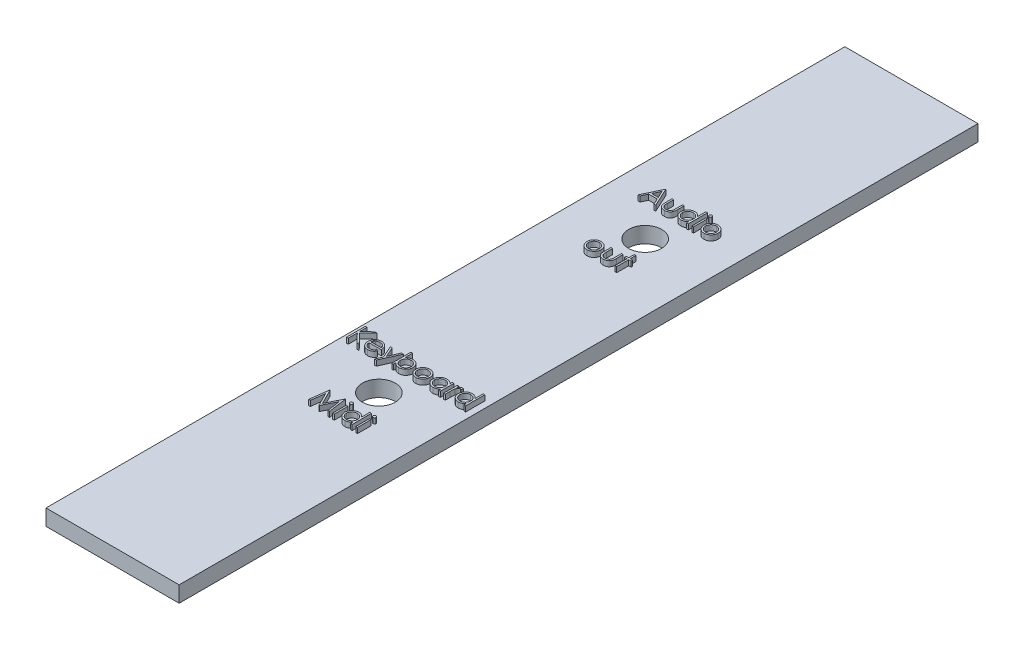
from build123d import *

# Parameters (mm, degrees)
SKETCH1_W           = 25
SKETCH1_H           = 150
SKETCH1_R           = 3.1
BOSS_EXTRUDE1_DEPTH = 3
SKETCH2_W           = 0.314102564
SKETCH2_H           = 2.557692308
BOSS_EXTRUDE2_DEPTH = 1


with BuildPart() as part:
    # Sketch1 → Boss-Extrude1 (new body)
    with BuildSketch(Plane(origin=(0, 0, 0), x_dir=(1, 0, 0), z_dir=(0, 1, 0))):
        with Locations((12.5, -75)):
            Rectangle(SKETCH1_W, SKETCH1_H)
        with Locations(Location((12.5, -50, 0), (0, 0, 270))):
            Circle(SKETCH1_R, mode=Mode.SUBTRACT)
        with Locations(Location((12.5, -100, 0), (0, 0, 270))):
            Circle(SKETCH1_R, mode=Mode.SUBTRACT)
    extrude(amount=BOSS_EXTRUDE1_DEPTH)

    # Sketch2 → Boss-Extrude2 (add)
    # profile 1 of 23: a face of its own
    with BuildSketch(Plane(origin=(0, 3, 0), x_dir=(1, 0, 0), z_dir=(0, 1, 0))):
        Polygon((7.384615385, -41), (9, -44.5), (8.658553686, -44.5), (8.141125801, -43.378205128), (6.554487179, -43.378205128), (6.022335737, -44.5), (5.679487179, -44.5), (7.33974359, -41), align=None)
        Polygon((7.358673878, -41.682191506), (6.724859776, -43.019230769), (7.975661058, -43.019230769), align=None, mode=Mode.SUBTRACT)
    # profile 2 of 23: a face of its own
    with BuildSketch(Plane(origin=(0, 3, 0), x_dir=(1, 0, 0), z_dir=(0, 1, 0))):
        with BuildLine():
            Line((9.493589744, -41.942307692), (9.807692308, -41.942307692))
            Line((9.807692308, -41.942307692), (9.807692308, -43.128605769))
            add(Edge.make_bspline(
                [(9.807692308, -43.128605769), (9.807834213, -43.163428518), (9.80810567, -43.230042806), (9.809946611, -43.325897993), (9.814276705, -43.413314706), (9.819690529, -43.492343443), (9.826652665, -43.562970834), (9.834936026, -43.624950191), (9.844194447, -43.678984375), (9.853257161, -43.711527731), (9.857471955, -43.72666266)],
                knots=[0, 0, 0, 0, 1.388932606, 2.656963016, 3.823490214, 4.879454478, 5.816252168, 6.653371382, 7.373723809, 8, 8, 8, 8], degree=3))
            add(Edge.make_bspline(
                [(9.857471955, -43.72666266), (9.86423341, -43.745685531), (9.877615751, -43.783335792), (9.901889235, -43.837724798), (9.931917571, -43.88810008), (9.964777399, -43.936404153), (10.002676807, -43.98120614), (10.045136278, -44.022430383), (10.090734515, -44.061634474), (10.158489538, -44.108019266), (10.251148804, -44.157734597), (10.37280156, -44.200630415), (10.504705786, -44.226266235), (10.595870505, -44.22924049), (10.642728365, -44.230769231)],
                knots=[0, 0, 0, 0, 0.725840625, 1.436591201, 2.137033971, 2.831655856, 3.53531722, 4.242432219, 4.957935707, 5.694543706, 7.190802206, 8.724350549, 10.316345118, 12, 12, 12, 12], degree=3))
            add(Edge.make_bspline(
                [(10.642728365, -44.230769231), (10.689581873, -44.229207982), (10.780234741, -44.226187255), (10.910689711, -44.201403716), (11.029941125, -44.159998027), (11.136792076, -44.102190616), (11.230757917, -44.031448553), (11.309062335, -43.948439744), (11.37366959, -43.855790357), (11.401879011, -43.786666078), (11.416065705, -43.751903045)],
                knots=[0, 0, 0, 0, 1.157059328, 2.238695713, 3.266970494, 4.264342957, 5.228770407, 6.160125903, 7.074715775, 8, 8, 8, 8], degree=3))
            add(Edge.make_bspline(
                [(11.416065705, -43.751903045), (11.420259935, -43.737936746), (11.429532354, -43.707060671), (11.439494705, -43.654680922), (11.448469167, -43.592216318), (11.456132343, -43.519258109), (11.461597505, -43.435996957), (11.464543532, -43.342458881), (11.467871807, -43.23893752), (11.467922323, -43.166469761), (11.467948718, -43.128605769)],
                knots=[0, 0, 0, 0, 0.557542046, 1.232589297, 2.036731608, 2.971723315, 4.038036528, 5.22795436, 6.551621927, 8, 8, 8, 8], degree=3))
            Line((11.467948718, -43.128605769), (11.467948718, -41.942307692))
            Line((11.467948718, -41.942307692), (11.782051282, -41.942307692))
            Line((11.782051282, -41.942307692), (11.782051282, -43.1875))
            add(Edge.make_bspline(
                [(11.782051282, -43.1875), (11.781609587, -43.229807171), (11.780752639, -43.311888871), (11.775245295, -43.431172983), (11.765795683, -43.542335228), (11.751452998, -43.645434448), (11.734587323, -43.740391929), (11.71283105, -43.827329375), (11.686852812, -43.905978929), (11.657547297, -43.977720706), (11.62292543, -44.0427676), (11.586098409, -44.104503417), (11.543573638, -44.161396352), (11.498803403, -44.216278489), (11.449001747, -44.266420017), (11.395101888, -44.312971493), (11.337862469, -44.356644524), (11.276013271, -44.395735804), (11.210457208, -44.430952449), (11.141113351, -44.462168527), (11.067132352, -44.486871104), (10.989468716, -44.50818177), (10.907741936, -44.524896239), (10.822030803, -44.536682806), (10.732364187, -44.543908137), (10.671254727, -44.544545182), (10.639923878, -44.544871795)],
                knots=[0, 0, 0, 0, 1.493040784, 2.896703357, 4.213163133, 5.428574705, 6.569057535, 7.615249723, 8.588095153, 9.490268104, 10.346124644, 11.18633936, 12.024365274, 12.850166724, 13.684164916, 14.514361689, 15.362232829, 16.222528818, 17.093394965, 17.986930858, 18.902426812, 19.842810585, 20.827885679, 21.843828298, 22.894529745, 24, 24, 24, 24], degree=3))
            add(Edge.make_bspline(
                [(10.639923878, -44.544871795), (10.608827364, -44.544532088), (10.547719819, -44.543864532), (10.458048575, -44.536722724), (10.372099968, -44.524914553), (10.29017957, -44.508059336), (10.212205173, -44.487020266), (10.137860933, -44.46201673), (10.06801737, -44.430936249), (10.001835366, -44.395958691), (9.939832978, -44.356393416), (9.881724399, -44.313025376), (9.827587547, -44.265919313), (9.777410479, -44.215271956), (9.731897502, -44.16045502), (9.690481461, -44.101909459), (9.652524755, -44.040215371), (9.618171965, -43.974152208), (9.58866021, -43.901580198), (9.562604964, -43.821283101), (9.541294325, -43.732380585), (9.523951857, -43.634948656), (9.510000416, -43.529453615), (9.500314274, -43.415285199), (9.494898443, -43.292721507), (9.494035382, -43.208071617), (9.493589744, -43.164362981)],
                knots=[0, 0, 0, 0, 1.083640291, 2.129454052, 3.13281866, 4.105697902, 5.042300162, 5.946461698, 6.836384745, 7.703652036, 8.553297018, 9.397182691, 10.228592656, 11.052265423, 11.879314572, 12.708807002, 13.549817954, 14.402308542, 15.300838682, 16.27712199, 17.341985831, 18.484375296, 19.725102775, 21.0496083, 22.476576903, 24, 24, 24, 24], degree=3))
            Line((9.493589744, -43.164362981), (9.493589744, -41.942307692))
        make_face()
    # profile 3 of 23: a face of its own
    with BuildSketch(Plane(origin=(0, 3, 0), x_dir=(1, 0, 0), z_dir=(0, 1, 0))):
        with BuildLine():
            Line((15.102564103, -40.91025641), (15.102564103, -44.5))
            Line((15.102564103, -44.5), (14.788461538, -44.5))
            Line((14.788461538, -44.5), (14.788461538, -44.057592147))
            add(Edge.make_bspline(
                [(14.788461538, -44.057592147), (14.753042748, -44.097631741), (14.683922533, -44.175769512), (14.568481415, -44.277851685), (14.446113237, -44.362230007), (14.317411916, -44.430379922), (14.182493672, -44.481571979), (14.041657585, -44.517958138), (13.894846204, -44.541351973), (13.794593849, -44.543687995), (13.743790064, -44.544871795)],
                knots=[0, 0, 0, 0, 1.074387032, 2.096679803, 3.090159297, 4.057316773, 5.018401886, 5.985159533, 6.978961417, 8, 8, 8, 8], degree=3))
            add(Edge.make_bspline(
                [(13.743790064, -44.544871795), (13.69862211, -44.543645423), (13.609548905, -44.541226962), (13.478519828, -44.522464659), (13.352427579, -44.492334037), (13.231153006, -44.450433147), (13.115480861, -44.394852326), (13.004420764, -44.328311078), (12.898548072, -44.249070248), (12.799476533, -44.158482219), (12.708244533, -44.060087232), (12.62818326, -43.955141685), (12.56143018, -43.844099381), (12.505610099, -43.728366227), (12.462613755, -43.607051308), (12.432640121, -43.48057414), (12.413899674, -43.349084266), (12.411482213, -43.259544743), (12.41025641, -43.214142628)],
                knots=[0, 0, 0, 0, 1.033919861, 2.038935746, 3.024066025, 3.998881131, 4.97069526, 5.957263378, 6.95902576, 7.993208707, 9.027059324, 10.027763471, 11.009749337, 11.988697705, 12.965288445, 13.950418724, 14.960734635, 16, 16, 16, 16], degree=3))
            add(Edge.make_bspline(
                [(12.41025641, -43.214142628), (12.411509382, -43.169678925), (12.413986438, -43.081776581), (12.432439658, -42.952497883), (12.463470667, -42.827979623), (12.507018515, -42.708622679), (12.56286047, -42.594282629), (12.630788557, -42.484878604), (12.710807681, -42.380109207), (12.803060088, -42.28243798), (12.902994859, -42.192217366), (13.009903589, -42.11380832), (13.121126871, -42.046091471), (13.238389881, -41.992437995), (13.359956986, -41.949028891), (13.486910432, -41.918995922), (13.61872201, -41.901298601), (13.708212503, -41.898735837), (13.753605769, -41.897435897)],
                knots=[0, 0, 0, 0, 1.020392517, 2.01726096, 2.990465484, 3.961182959, 4.928053699, 5.906110375, 6.912531644, 7.948652711, 8.985773172, 9.998621852, 10.987621588, 11.969261332, 12.953316658, 13.946091881, 14.958173133, 16, 16, 16, 16], degree=3))
            add(Edge.make_bspline(
                [(13.753605769, -41.897435897), (13.805822577, -41.899002993), (13.908318368, -41.902079029), (14.058216889, -41.927785396), (14.2000045, -41.970948274), (14.334497487, -42.030039555), (14.460894047, -42.106840306), (14.580120688, -42.199591754), (14.690104011, -42.3109189), (14.755175833, -42.394530474), (14.788461538, -42.437299679)],
                knots=[0, 0, 0, 0, 1.031072012, 2.023879775, 2.993683497, 3.952812103, 4.918022106, 5.908088563, 6.929940113, 8, 8, 8, 8], degree=3))
            Line((14.788461538, -42.437299679), (14.788461538, -40.91025641))
            Line((14.788461538, -40.91025641), (15.102564103, -40.91025641))
        make_face()
        with BuildLine():
            add(Edge.make_bspline(
                [(13.7578125, -42.211538462), (13.711898162, -42.213172099), (13.621270562, -42.21639664), (13.48822656, -42.241570135), (13.360913146, -42.28345473), (13.239967072, -42.340736631), (13.127298855, -42.412765368), (13.026605184, -42.499886751), (12.937062483, -42.599723765), (12.861754219, -42.711825875), (12.800363722, -42.832003967), (12.75719669, -42.957628405), (12.728727442, -43.086433382), (12.725818922, -43.173796068), (12.724358974, -43.217648237)],
                knots=[0, 0, 0, 0, 1.031046209, 2.035121221, 3.029706178, 4.034933723, 5.034054252, 6.02443088, 7.017295772, 8.038157696, 9.050218397, 10.03989886, 11.016116709, 12, 12, 12, 12], degree=3))
            add(Edge.make_bspline(
                [(12.724358974, -43.217648237), (12.726223868, -43.261238344), (12.729946345, -43.3482477), (12.756697039, -43.477228277), (12.801576912, -43.602882319), (12.862818975, -43.724143313), (12.9395056, -43.836727413), (13.028394252, -43.938467536), (13.130344534, -44.025957124), (13.243272041, -44.099194697), (13.363880011, -44.158357218), (13.490713943, -44.199522858), (13.621389581, -44.226100638), (13.710241915, -44.229205115), (13.755008013, -44.230769231)],
                knots=[0, 0, 0, 0, 0.979072187, 1.954306742, 2.945804271, 3.96968567, 4.997920485, 5.998718438, 6.996577872, 8.005894225, 9.015743152, 10.005417472, 10.995077863, 12, 12, 12, 12], degree=3))
            add(Edge.make_bspline(
                [(13.755008013, -44.230769231), (13.800454516, -44.229109267), (13.890843102, -44.225807763), (14.02428181, -44.200526498), (14.153776773, -44.1587577), (14.277564001, -44.100858573), (14.392880132, -44.029101217), (14.49637801, -43.945094126), (14.583893978, -43.847390942), (14.658086588, -43.740014489), (14.716262005, -43.622302492), (14.758638064, -43.496968302), (14.78369197, -43.364007553), (14.786849699, -43.273143626), (14.788461538, -43.226762821)],
                knots=[0, 0, 0, 0, 1.01762866, 2.023962475, 3.030623092, 4.058876274, 5.077231937, 6.066672613, 7.034107872, 8.005628644, 8.981990164, 9.965428785, 10.961468474, 12, 12, 12, 12], degree=3))
            add(Edge.make_bspline(
                [(14.788461538, -43.226762821), (14.787501882, -43.19142499), (14.785612975, -43.121868957), (14.771182405, -43.019741439), (14.748227479, -42.922007713), (14.715881309, -42.828565024), (14.673390024, -42.739930009), (14.622142258, -42.655466248), (14.561236809, -42.575613037), (14.491654113, -42.501469966), (14.41548891, -42.433843504), (14.334894369, -42.373479263), (14.248915622, -42.32389049), (14.158998586, -42.282849219), (14.064987251, -42.250190069), (13.966116631, -42.228402375), (13.863437644, -42.213442054), (13.793391589, -42.212179673), (13.7578125, -42.211538462)],
                knots=[0, 0, 0, 0, 1.050140795, 2.067009409, 3.05949893, 4.030605086, 5.00011959, 5.97591094, 6.962425594, 7.979863591, 8.993523472, 9.986985069, 10.967611495, 11.937549037, 12.921786183, 13.919465291, 14.943216303, 16, 16, 16, 16], degree=3))
        make_face(mode=Mode.SUBTRACT)
    # profile 4 of 23: a face of its own
    with BuildSketch(Plane(origin=(0, 3, 0), x_dir=(1, 0, 0), z_dir=(0, 1, 0))):
        with BuildLine():
            add(Edge.make_bspline(
                [(15.931290064, -40.865384615), (15.95078138, -40.866288768), (15.98894912, -40.868059272), (16.044142387, -40.883220749), (16.094399399, -40.908920434), (16.138977132, -40.943400115), (16.177229019, -40.983949559), (16.204009729, -41.031210527), (16.221222126, -41.082269166), (16.223300681, -41.117884255), (16.224358974, -41.136017628)],
                knots=[0, 0, 0, 0, 1.055194115, 2.066272739, 3.074728998, 4.095836921, 5.109056067, 6.073838105, 7.019297344, 8, 8, 8, 8], degree=3))
            add(Edge.make_bspline(
                [(16.224358974, -41.136017628), (16.223276815, -41.153680281), (16.221137513, -41.188597256), (16.204023024, -41.238770728), (16.177000787, -41.285375012), (16.139001661, -41.325845722), (16.0943929, -41.360306342), (16.044144114, -41.386011081), (15.988948666, -41.401171218), (15.950781226, -41.402941907), (15.931290064, -41.403846154)],
                knots=[0, 0, 0, 0, 0.96129708, 1.900370562, 2.859976407, 3.87933698, 4.906634145, 5.921202961, 6.938410037, 8, 8, 8, 8], degree=3))
            add(Edge.make_bspline(
                [(15.931290064, -41.403846154), (15.912021789, -41.402976434), (15.874518609, -41.401283637), (15.820151766, -41.385713619), (15.770323277, -41.360297546), (15.725658604, -41.326071361), (15.688428411, -41.285126464), (15.661330086, -41.23879917), (15.644255124, -41.188590015), (15.642110495, -41.153677849), (15.641025641, -41.136017628)],
                knots=[0, 0, 0, 0, 1.054934014, 2.053291228, 3.073705704, 4.106921865, 5.123545215, 6.088680038, 7.033164197, 8, 8, 8, 8], degree=3))
            add(Edge.make_bspline(
                [(15.641025641, -41.136017628), (15.642086728, -41.117886779), (15.644170769, -41.082276646), (15.661342885, -41.031181613), (15.688202693, -40.984200111), (15.725683256, -40.943174612), (15.770316716, -40.908929177), (15.820153462, -40.883518196), (15.874518161, -40.867946856), (15.912021637, -40.866254242), (15.931290064, -40.865384615)],
                knots=[0, 0, 0, 0, 0.98631895, 1.937192651, 2.907499808, 3.917963147, 4.944918757, 5.95915025, 6.951458133, 8, 8, 8, 8], degree=3))
        make_face()
    # profile 5 of 23: a face of its own
    with BuildSketch(Plane(origin=(0, 3, 0), x_dir=(1, 0, 0), z_dir=(0, 1, 0))):
        with Locations((15.932692308, -43.221153846)):
            Rectangle(SKETCH2_W, SKETCH2_H)
    # profile 6 of 23: a face of its own
    with BuildSketch(Plane(origin=(0, 3, 0), x_dir=(1, 0, 0), z_dir=(0, 1, 0))):
        with BuildLine():
            add(Edge.make_bspline(
                [(18.087940705, -41.897435897), (18.135931978, -41.898457789), (18.230031136, -41.900461467), (18.367839021, -41.921876433), (18.499384157, -41.954623797), (18.62517035, -41.999895359), (18.743586645, -42.06057731), (18.856357889, -42.132986601), (18.963174898, -42.218769195), (19.027197927, -42.285127263), (19.059695513, -42.318810096)],
                knots=[0, 0, 0, 0, 1.054011418, 2.066658804, 3.057071809, 4.030435133, 4.997543892, 5.974964718, 6.972108034, 8, 8, 8, 8], degree=3))
            add(Edge.make_bspline(
                [(19.059695513, -42.318810096), (19.087677467, -42.351024082), (19.143099847, -42.414828624), (19.214165566, -42.518284237), (19.275387126, -42.625424338), (19.324450087, -42.737671664), (19.363135111, -42.854046336), (19.390600807, -42.974948347), (19.406937742, -43.100110694), (19.409140709, -43.185114532), (19.41025641, -43.228165064)],
                knots=[0, 0, 0, 0, 1.025258237, 2.030674902, 3.01204498, 3.988269485, 4.97094183, 5.956517959, 6.965070386, 8, 8, 8, 8], degree=3))
            add(Edge.make_bspline(
                [(19.41025641, -43.228165064), (19.409275073, -43.271465122), (19.407335905, -43.357028055), (19.388992288, -43.483047421), (19.360461202, -43.605242244), (19.319629364, -43.723100937), (19.267271255, -43.836983765), (19.203380567, -43.946393314), (19.12750895, -44.051545447), (19.041504953, -44.151547286), (18.946453077, -44.2437135), (18.843336929, -44.32404177), (18.734182895, -44.392863294), (18.617539542, -44.44829971), (18.494472055, -44.49200941), (18.364714987, -44.522709427), (18.228469917, -44.54127111), (18.135442695, -44.543654684), (18.087940705, -44.544871795)],
                knots=[0, 0, 0, 0, 0.998656419, 1.973391657, 2.932242238, 3.890759089, 4.846373663, 5.82037756, 6.809684879, 7.83454468, 8.860553229, 9.859544525, 10.845671541, 11.83227036, 12.833544569, 13.85385346, 14.904124723, 16, 16, 16, 16], degree=3))
            add(Edge.make_bspline(
                [(18.087940705, -44.544871795), (18.040205986, -44.543650599), (17.946715126, -44.541258824), (17.809989144, -44.522781541), (17.679999525, -44.492023559), (17.556770927, -44.448156066), (17.43962608, -44.392861522), (17.329839583, -44.324249833), (17.226639667, -44.243689678), (17.131567683, -44.151553741), (17.045569077, -44.051543784), (16.969696069, -43.946393746), (16.905805743, -43.836983652), (16.853447539, -43.723100967), (16.812615726, -43.605242236), (16.784084633, -43.483047423), (16.765741019, -43.357028055), (16.76380185, -43.271465122), (16.762820513, -43.228165064)],
                knots=[0, 0, 0, 0, 1.099876186, 2.154163076, 3.173186993, 4.173200201, 5.163417411, 6.152872554, 7.150605724, 8.17532212, 9.198891216, 10.186952605, 11.159729845, 12.11414092, 13.071450619, 14.029093627, 15.002601286, 16, 16, 16, 16], degree=3))
            add(Edge.make_bspline(
                [(16.762820513, -43.228165064), (16.763943823, -43.185348518), (16.766167785, -43.100579116), (16.782488294, -42.975652055), (16.80984685, -42.854954666), (16.848578247, -42.73902919), (16.898093438, -42.627273754), (16.958454725, -42.519868923), (17.030245358, -42.416881123), (17.08544731, -42.353159043), (17.11338141, -42.320913462)],
                knots=[0, 0, 0, 0, 1.031353054, 2.041901799, 3.029428768, 4.008703097, 4.981709435, 5.96992636, 6.972712378, 8, 8, 8, 8], degree=3))
            add(Edge.make_bspline(
                [(17.11338141, -42.320913462), (17.145830001, -42.286938522), (17.209645865, -42.220120826), (17.316994593, -42.134588302), (17.429488414, -42.060672228), (17.54921334, -42.001196013), (17.674896198, -41.954357495), (17.807115441, -41.92179198), (17.945390956, -41.900538625), (18.039950577, -41.898480447), (18.087940705, -41.897435897)],
                knots=[0, 0, 0, 0, 1.027980169, 2.021703884, 2.998553061, 3.971491411, 4.943284454, 5.930300938, 6.949603206, 8, 8, 8, 8], degree=3))
        make_face()
        with BuildLine():
            add(Edge.make_bspline(
                [(18.086538462, -42.211538462), (18.05260085, -42.212503053), (17.985601722, -42.214407336), (17.886982137, -42.22889124), (17.792041983, -42.251838745), (17.700601139, -42.284442801), (17.612967966, -42.3265417), (17.529058564, -42.37825006), (17.448626124, -42.438883016), (17.373244061, -42.508345688), (17.304061749, -42.584224683), (17.243583772, -42.665073041), (17.192158666, -42.749579388), (17.149318507, -42.837831599), (17.117411319, -42.930724013), (17.094238296, -43.027204644), (17.079768056, -43.12747006), (17.077881677, -43.195631079), (17.076923077, -43.230268429)],
                knots=[0, 0, 0, 0, 1.021534396, 2.016698045, 2.994645724, 3.958388632, 4.93408049, 5.916473867, 6.921342795, 7.962252576, 8.998418191, 10.008913653, 10.997312074, 11.973003931, 12.956656626, 13.948281152, 14.957379055, 16, 16, 16, 16], degree=3))
            add(Edge.make_bspline(
                [(17.076923077, -43.230268429), (17.078529901, -43.275020457), (17.081719145, -43.363844862), (17.107654381, -43.494655985), (17.151040661, -43.620237837), (17.209627941, -43.739854223), (17.28303416, -43.850526501), (17.369521226, -43.949197985), (17.468160927, -44.034383797), (17.577777427, -44.105064642), (17.696131745, -44.161224398), (17.821388066, -44.201023374), (17.95202876, -44.226895066), (18.041309491, -44.229466541), (18.086538462, -44.230769231)],
                knots=[0, 0, 0, 0, 1.016792936, 2.018143844, 3.017858371, 4.030088057, 5.03801393, 6.028138512, 7.003788237, 7.991172063, 8.984598303, 9.972568034, 10.972917682, 12, 12, 12, 12], degree=3))
            add(Edge.make_bspline(
                [(18.086538462, -44.230769231), (18.13176483, -44.229458951), (18.221040426, -44.226872494), (18.351499603, -44.201153674), (18.476413575, -44.161050013), (18.594644963, -44.105127803), (18.704211566, -44.034115389), (18.803560687, -43.949679012), (18.889309299, -43.85026516), (18.962642903, -43.739707631), (19.022189646, -43.620423279), (19.065372848, -43.494632807), (19.091370434, -43.363850765), (19.094551263, -43.275022434), (19.096153846, -43.230268429)],
                knots=[0, 0, 0, 0, 1.02726834, 2.027799167, 3.010890988, 4.004497153, 4.992059811, 5.971914811, 6.958719428, 7.966827853, 8.981595046, 9.981490638, 10.983022906, 12, 12, 12, 12], degree=3))
            add(Edge.make_bspline(
                [(19.096153846, -43.230268429), (19.095195576, -43.195630872), (19.093309847, -43.127469446), (19.078834883, -43.027206993), (19.055679343, -42.930715396), (19.023707726, -42.837863393), (18.981053712, -42.749350888), (18.928636919, -42.665321161), (18.868405893, -42.583944615), (18.798388772, -42.508590974), (18.723085395, -42.438855938), (18.642620356, -42.378226548), (18.558835378, -42.326768953), (18.471456795, -42.284082712), (18.380004228, -42.252135372), (18.285197098, -42.228758741), (18.186998288, -42.214468544), (18.120239245, -42.212521402), (18.086538462, -42.211538462)],
                knots=[0, 0, 0, 0, 1.042956736, 2.052379634, 3.044323526, 4.02829302, 5.004299113, 5.996692471, 7.007513377, 8.048758398, 9.090003419, 10.095195979, 11.07790575, 12.047570684, 13.018257071, 13.989683339, 14.985167495, 16, 16, 16, 16], degree=3))
        make_face(mode=Mode.SUBTRACT)
    # profile 7 of 23: a face of its own
    with BuildSketch(Plane(origin=(0, 3, 0), x_dir=(1, 0, 0), z_dir=(0, 1, 0))):
        with BuildLine():
            add(Edge.make_bspline(
                [(9.786658654, -55.564102564), (9.834649927, -55.565124455), (9.928749084, -55.567128134), (10.06655697, -55.5885431), (10.198102106, -55.621290464), (10.323888298, -55.666562026), (10.442304594, -55.727243977), (10.555075838, -55.799653268), (10.661892847, -55.885435861), (10.725915876, -55.95179393), (10.758413462, -55.985476763)],
                knots=[0, 0, 0, 0, 1.054011418, 2.066658804, 3.057071809, 4.030435133, 4.997543892, 5.974964718, 6.972108034, 8, 8, 8, 8], degree=3))
            add(Edge.make_bspline(
                [(10.758413462, -55.985476763), (10.786395416, -56.017690749), (10.841817796, -56.081495291), (10.912883515, -56.184950904), (10.974105075, -56.292091004), (11.023168036, -56.404338331), (11.061853059, -56.520713002), (11.089318756, -56.641615013), (11.105655691, -56.766777361), (11.107858658, -56.851781199), (11.108974359, -56.894831731)],
                knots=[0, 0, 0, 0, 1.025258237, 2.030674902, 3.01204498, 3.988269485, 4.97094183, 5.956517959, 6.965070386, 8, 8, 8, 8], degree=3))
            add(Edge.make_bspline(
                [(11.108974359, -56.894831731), (11.107993022, -56.938131788), (11.106053853, -57.023694722), (11.087710237, -57.149714088), (11.059179151, -57.27190891), (11.018347313, -57.389767604), (10.965989204, -57.503650431), (10.902098516, -57.613059981), (10.826226899, -57.718212114), (10.740222902, -57.818213952), (10.645171026, -57.910380167), (10.542054878, -57.990708437), (10.432900844, -58.059529961), (10.316257491, -58.114966377), (10.193190004, -58.158676077), (10.063432936, -58.189376093), (9.927187865, -58.207937777), (9.834160644, -58.21032135), (9.786658654, -58.211538462)],
                knots=[0, 0, 0, 0, 0.998656419, 1.973391657, 2.932242238, 3.890759089, 4.846373663, 5.82037756, 6.809684879, 7.83454468, 8.860553229, 9.859544525, 10.845671541, 11.83227036, 12.833544569, 13.85385346, 14.904124723, 16, 16, 16, 16], degree=3))
            add(Edge.make_bspline(
                [(9.786658654, -58.211538462), (9.738923934, -58.210317265), (9.645433075, -58.207925491), (9.508707093, -58.189448208), (9.378717474, -58.158690226), (9.255488875, -58.114822733), (9.138344028, -58.059528189), (9.028557531, -57.990916499), (8.925357616, -57.910356344), (8.830285631, -57.818220407), (8.744287026, -57.718210451), (8.668414018, -57.613060412), (8.604523692, -57.503650319), (8.552165488, -57.389767634), (8.511333675, -57.271908902), (8.482802582, -57.14971409), (8.464458968, -57.023694721), (8.462519799, -56.938131788), (8.461538462, -56.894831731)],
                knots=[0, 0, 0, 0, 1.099876186, 2.154163076, 3.173186993, 4.173200201, 5.163417411, 6.152872554, 7.150605724, 8.17532212, 9.198891216, 10.186952605, 11.159729845, 12.11414092, 13.071450619, 14.029093627, 15.002601286, 16, 16, 16, 16], degree=3))
            add(Edge.make_bspline(
                [(8.461538462, -56.894831731), (8.462661772, -56.852015185), (8.464885733, -56.767245782), (8.481206242, -56.642318722), (8.508564799, -56.521621333), (8.547296195, -56.405695857), (8.596811386, -56.293940421), (8.657172674, -56.18653559), (8.728963307, -56.083547789), (8.784165258, -56.019825709), (8.812099359, -55.987580128)],
                knots=[0, 0, 0, 0, 1.031353054, 2.041901799, 3.029428768, 4.008703097, 4.981709435, 5.96992636, 6.972712378, 8, 8, 8, 8], degree=3))
            add(Edge.make_bspline(
                [(8.812099359, -55.987580128), (8.84454795, -55.953605189), (8.908363814, -55.886787493), (9.015712542, -55.801254969), (9.128206363, -55.727338895), (9.247931289, -55.667862679), (9.373614147, -55.621024162), (9.505833389, -55.588458646), (9.644108905, -55.567205292), (9.738668526, -55.565147114), (9.786658654, -55.564102564)],
                knots=[0, 0, 0, 0, 1.027980169, 2.021703884, 2.998553061, 3.971491411, 4.943284454, 5.930300938, 6.949603206, 8, 8, 8, 8], degree=3))
        make_face()
        with BuildLine():
            add(Edge.make_bspline(
                [(9.78525641, -55.878205128), (9.751318799, -55.87916972), (9.68431967, -55.881074002), (9.585700086, -55.895557907), (9.490759932, -55.918505411), (9.399319087, -55.951109467), (9.311685915, -55.993208366), (9.227776513, -56.044916727), (9.147344073, -56.105549683), (9.071962009, -56.175012355), (9.002779697, -56.250891349), (8.942301721, -56.331739708), (8.890876614, -56.416246054), (8.848036455, -56.504498266), (8.816129267, -56.597390679), (8.792956245, -56.693871311), (8.778486004, -56.794136727), (8.776599626, -56.862297745), (8.775641026, -56.896935096)],
                knots=[0, 0, 0, 0, 1.021534396, 2.016698045, 2.994645724, 3.958388632, 4.93408049, 5.916473867, 6.921342795, 7.962252576, 8.998418191, 10.008913653, 10.997312074, 11.973003931, 12.956656626, 13.948281152, 14.957379055, 16, 16, 16, 16], degree=3))
            add(Edge.make_bspline(
                [(8.775641026, -56.896935096), (8.777247849, -56.941687123), (8.780437094, -57.030511529), (8.80637233, -57.161322651), (8.84975861, -57.286904504), (8.90834589, -57.40652089), (8.981752108, -57.517193168), (9.068239175, -57.615864652), (9.166878875, -57.701050463), (9.276495376, -57.771731309), (9.394849694, -57.827891065), (9.520106015, -57.86769004), (9.650746709, -57.893561733), (9.74002744, -57.896133207), (9.78525641, -57.897435897)],
                knots=[0, 0, 0, 0, 1.016792936, 2.018143844, 3.017858371, 4.030088057, 5.03801393, 6.028138512, 7.003788237, 7.991172063, 8.984598303, 9.972568034, 10.972917682, 12, 12, 12, 12], degree=3))
            add(Edge.make_bspline(
                [(9.78525641, -57.897435897), (9.830482779, -57.896125617), (9.919758375, -57.89353916), (10.050217552, -57.867820341), (10.175131524, -57.82771668), (10.293362911, -57.77179447), (10.402929515, -57.700782055), (10.502278636, -57.616345678), (10.588027247, -57.516931827), (10.661360852, -57.406374298), (10.720907595, -57.287089946), (10.764090797, -57.161299474), (10.790088383, -57.030517432), (10.793269211, -56.941689101), (10.794871795, -56.896935096)],
                knots=[0, 0, 0, 0, 1.02726834, 2.027799167, 3.010890988, 4.004497153, 4.992059811, 5.971914811, 6.958719428, 7.966827853, 8.981595046, 9.981490638, 10.983022906, 12, 12, 12, 12], degree=3))
            add(Edge.make_bspline(
                [(10.794871795, -56.896935096), (10.793913525, -56.862297538), (10.792027796, -56.794136113), (10.777552831, -56.693873659), (10.754397292, -56.597382063), (10.722425674, -56.504530059), (10.679771661, -56.416017555), (10.627354868, -56.331987828), (10.567123842, -56.250611282), (10.497106721, -56.175257641), (10.421803343, -56.105522604), (10.341338305, -56.044893215), (10.257553327, -55.99343562), (10.170174744, -55.950749379), (10.078722176, -55.918802039), (9.983915047, -55.895425407), (9.885716237, -55.881135211), (9.818957194, -55.879188069), (9.78525641, -55.878205128)],
                knots=[0, 0, 0, 0, 1.042956736, 2.052379634, 3.044323526, 4.02829302, 5.004299113, 5.996692471, 7.007513377, 8.048758398, 9.090003419, 10.095195979, 11.07790575, 12.047570684, 13.018257071, 13.989683339, 14.985167495, 16, 16, 16, 16], degree=3))
        make_face(mode=Mode.SUBTRACT)
    # profile 8 of 23: a face of its own
    with BuildSketch(Plane(origin=(0, 3, 0), x_dir=(1, 0, 0), z_dir=(0, 1, 0))):
        with BuildLine():
            Line((11.692307692, -55.608974359), (12.006410256, -55.608974359))
            Line((12.006410256, -55.608974359), (12.006410256, -56.795272436))
            add(Edge.make_bspline(
                [(12.006410256, -56.795272436), (12.006552161, -56.830095185), (12.006823619, -56.896709473), (12.00866456, -56.99256466), (12.012994653, -57.079981373), (12.018408478, -57.159010109), (12.025370614, -57.229637501), (12.033653974, -57.291616858), (12.042912396, -57.345651042), (12.05197511, -57.378194398), (12.056189904, -57.393329327)],
                knots=[0, 0, 0, 0, 1.388932606, 2.656963016, 3.823490214, 4.879454478, 5.816252168, 6.653371382, 7.373723809, 8, 8, 8, 8], degree=3))
            add(Edge.make_bspline(
                [(12.056189904, -57.393329327), (12.062951359, -57.412352198), (12.0763337, -57.450002459), (12.100607184, -57.504391464), (12.13063552, -57.554766747), (12.163495348, -57.603070819), (12.201394756, -57.647872806), (12.243854227, -57.68909705), (12.289452464, -57.728301141), (12.357207487, -57.774685933), (12.449866753, -57.824401263), (12.571519509, -57.867297082), (12.703423734, -57.892932902), (12.794588454, -57.895907157), (12.841446314, -57.897435897)],
                knots=[0, 0, 0, 0, 0.725840625, 1.436591201, 2.137033971, 2.831655856, 3.53531722, 4.242432219, 4.957935707, 5.694543706, 7.190802206, 8.724350549, 10.316345118, 12, 12, 12, 12], degree=3))
            add(Edge.make_bspline(
                [(12.841446314, -57.897435897), (12.888299822, -57.895874649), (12.97895269, -57.892853922), (13.109407659, -57.868070383), (13.228659074, -57.826664694), (13.335510025, -57.768857282), (13.429475865, -57.698115219), (13.507780284, -57.615106411), (13.572387539, -57.522457024), (13.600596959, -57.453332745), (13.614783654, -57.418569712)],
                knots=[0, 0, 0, 0, 1.157059328, 2.238695713, 3.266970494, 4.264342957, 5.228770407, 6.160125903, 7.074715775, 8, 8, 8, 8], degree=3))
            add(Edge.make_bspline(
                [(13.614783654, -57.418569712), (13.618977884, -57.404603413), (13.628250302, -57.373727337), (13.638212654, -57.321347589), (13.647187115, -57.258882985), (13.654850292, -57.185924776), (13.660315454, -57.102663623), (13.663261481, -57.009125547), (13.666589756, -56.905604187), (13.666640272, -56.833136428), (13.666666667, -56.795272436)],
                knots=[0, 0, 0, 0, 0.557542046, 1.232589297, 2.036731608, 2.971723315, 4.038036528, 5.22795436, 6.551621927, 8, 8, 8, 8], degree=3))
            Line((13.666666667, -56.795272436), (13.666666667, -55.608974359))
            Line((13.666666667, -55.608974359), (13.980769231, -55.608974359))
            Line((13.980769231, -55.608974359), (13.980769231, -56.854166667))
            add(Edge.make_bspline(
                [(13.980769231, -56.854166667), (13.980327536, -56.896473838), (13.979470588, -56.978555538), (13.973963244, -57.097839649), (13.964513631, -57.209001894), (13.950170946, -57.312101114), (13.933305272, -57.407058596), (13.911548999, -57.493996042), (13.885570761, -57.572645596), (13.856265246, -57.644387373), (13.821643379, -57.709434267), (13.784816358, -57.771170084), (13.742291586, -57.828063019), (13.697521352, -57.882945156), (13.647719696, -57.933086683), (13.593819837, -57.979638159), (13.536580417, -58.023311191), (13.474731219, -58.06240247), (13.409175156, -58.097619116), (13.339831299, -58.128835194), (13.265850301, -58.153537771), (13.188186664, -58.174848437), (13.106459885, -58.191562906), (13.020748752, -58.203349473), (12.931082136, -58.210574803), (12.869972676, -58.211211848), (12.838641827, -58.211538462)],
                knots=[0, 0, 0, 0, 1.493040784, 2.896703357, 4.213163133, 5.428574705, 6.569057535, 7.615249723, 8.588095153, 9.490268104, 10.346124644, 11.18633936, 12.024365274, 12.850166724, 13.684164916, 14.514361689, 15.362232829, 16.222528818, 17.093394965, 17.986930858, 18.902426812, 19.842810585, 20.827885679, 21.843828298, 22.894529745, 24, 24, 24, 24], degree=3))
            add(Edge.make_bspline(
                [(12.838641827, -58.211538462), (12.807545313, -58.211198754), (12.746437768, -58.210531198), (12.656766523, -58.203389391), (12.570817917, -58.19158122), (12.488897519, -58.174726002), (12.410923121, -58.153686933), (12.336578881, -58.128683397), (12.266735318, -58.097602915), (12.200553314, -58.062625358), (12.138550926, -58.023060082), (12.080442348, -57.979692043), (12.026305496, -57.93258598), (11.976128428, -57.881938623), (11.930615451, -57.827121686), (11.889199409, -57.768576126), (11.851242704, -57.706882037), (11.816889914, -57.640818875), (11.787378158, -57.568246865), (11.761322912, -57.487949768), (11.740012274, -57.399047251), (11.722669806, -57.301615323), (11.708718365, -57.196120281), (11.699032223, -57.081951866), (11.693616392, -56.959388174), (11.692753331, -56.874738284), (11.692307692, -56.831029647)],
                knots=[0, 0, 0, 0, 1.083640291, 2.129454052, 3.13281866, 4.105697902, 5.042300162, 5.946461698, 6.836384745, 7.703652036, 8.553297018, 9.397182691, 10.228592656, 11.052265423, 11.879314572, 12.708807002, 13.549817954, 14.402308542, 15.300838682, 16.27712199, 17.341985831, 18.484375296, 19.725102775, 21.0496083, 22.476576903, 24, 24, 24, 24], degree=3))
            Line((11.692307692, -56.831029647), (11.692307692, -55.608974359))
        make_face()
    # profile 9 of 23: a face of its own
    with BuildSketch(Plane(origin=(0, 3, 0), x_dir=(1, 0, 0), z_dir=(0, 1, 0))):
        Polygon((15.012820513, -54.576923077), (15.326923077, -54.576923077), (15.326923077, -55.608974359), (15.775641026, -55.608974359), (15.775641026, -55.923076923), (15.326923077, -55.923076923), (15.326923077, -58.166666667), (15.012820513, -58.166666667), (15.012820513, -55.923076923), (14.564102564, -55.923076923), (14.564102564, -55.608974359), (15.012820513, -55.608974359), align=None)
    # profile 10 of 23: a face of its own
    with BuildSketch(Plane(origin=(0, 3, 0), x_dir=(1, 0, 0), z_dir=(0, 1, 0))):
        Polygon((1.448717949, -91.5), (1.762820513, -91.5), (1.762820513, -92.832832532), (3.221854968, -91.5), (3.669871795, -91.5), (1.950020032, -93.070512821), (3.804487179, -95), (3.385917468, -95), (1.762820513, -93.310997596), (1.762820513, -95), (1.448717949, -95), align=None)
    # profile 11 of 23: a face of its own
    with BuildSketch(Plane(origin=(0, 3, 0), x_dir=(1, 0, 0), z_dir=(0, 1, 0))):
        with BuildLine():
            Line((6.329927885, -94.192307692), (6.608974359, -94.338842147))
            add(Edge.make_bspline(
                [(6.608974359, -94.338842147), (6.586737764, -94.378285479), (6.543474155, -94.455026582), (6.469073407, -94.560458442), (6.391081335, -94.655306158), (6.305977367, -94.737035812), (6.216307688, -94.808287197), (6.121575033, -94.870625022), (6.021286215, -94.923743542), (5.915436491, -94.96849607), (5.803136939, -95.002905564), (5.684115423, -95.027209785), (5.558143928, -95.042233054), (5.471797748, -95.043978194), (5.427584135, -95.044871795)],
                knots=[0, 0, 0, 0, 1.120438281, 2.179929193, 3.190490725, 4.156257408, 5.095198341, 6.022838206, 6.959905092, 7.901321166, 8.864066838, 9.862729781, 10.905609505, 12, 12, 12, 12], degree=3))
            add(Edge.make_bspline(
                [(5.427584135, -95.044871795), (5.378442157, -95.04372462), (5.282580395, -95.041486813), (5.143040648, -95.022194348), (5.01166123, -94.99072199), (4.888449527, -94.946756448), (4.773707274, -94.889329124), (4.667206419, -94.819369642), (4.568386893, -94.737237388), (4.480362684, -94.642220944), (4.401118801, -94.540538987), (4.331192981, -94.434583102), (4.27273555, -94.324619878), (4.22518294, -94.211349354), (4.186778075, -94.09548546), (4.160011371, -93.975973993), (4.144581623, -93.853138408), (4.142217178, -93.770041073), (4.141025641, -93.728165064)],
                knots=[0, 0, 0, 0, 1.145258523, 2.234067595, 3.276747158, 4.290159414, 5.277019952, 6.260822364, 7.254936242, 8.264827045, 9.274100331, 10.257902744, 11.220704747, 12.172965371, 13.118907548, 14.062713208, 15.023725156, 16, 16, 16, 16], degree=3))
            add(Edge.make_bspline(
                [(4.141025641, -93.728165064), (4.142084782, -93.688870234), (4.144183861, -93.610993069), (4.157414648, -93.495727524), (4.180862941, -93.383699072), (4.213039265, -93.274814624), (4.254590511, -93.16925649), (4.30542273, -93.066960426), (4.365615108, -92.968035287), (4.412087782, -92.905632153), (4.435496795, -92.874198718)],
                knots=[0, 0, 0, 0, 1.024358464, 2.0301432, 3.019427413, 4.004406732, 4.986367066, 5.972626655, 6.978780325, 8, 8, 8, 8], degree=3))
            add(Edge.make_bspline(
                [(4.435496795, -92.874198718), (4.467204478, -92.836329848), (4.529615424, -92.761791697), (4.63517178, -92.663853372), (4.749471976, -92.581809596), (4.871083602, -92.51380246), (5.001420076, -92.462128813), (5.138729367, -92.423621231), (5.284574953, -92.40204322), (5.384280174, -92.398995386), (5.435296474, -92.397435897)],
                knots=[0, 0, 0, 0, 1.030682036, 2.02871468, 2.997146059, 3.962720338, 4.930598197, 5.918074684, 6.934738563, 8, 8, 8, 8], degree=3))
            add(Edge.make_bspline(
                [(5.435296474, -92.397435897), (5.48774408, -92.398789946), (5.590634326, -92.401446282), (5.740666447, -92.426072615), (5.882627163, -92.46512517), (6.016459667, -92.52027896), (6.142177528, -92.591438512), (6.258963578, -92.679580353), (6.36881509, -92.781998441), (6.432723669, -92.86076165), (6.465244391, -92.900841346)],
                knots=[0, 0, 0, 0, 1.056321875, 2.072262726, 3.055038591, 4.01806755, 4.982017516, 5.957941055, 6.960871419, 8, 8, 8, 8], degree=3))
            add(Edge.make_bspline(
                [(6.465244391, -92.900841346), (6.487371329, -92.931044928), (6.531477922, -92.991251046), (6.586725022, -93.089422203), (6.634682417, -93.192132798), (6.673015378, -93.301043095), (6.70405488, -93.414862675), (6.726511698, -93.53440522), (6.739681317, -93.659635131), (6.742270014, -93.744961686), (6.743589744, -93.788461538)],
                knots=[0, 0, 0, 0, 0.94817472, 1.890038105, 2.849395472, 3.817997239, 4.812318967, 5.836947057, 6.897266129, 8, 8, 8, 8], degree=3))
            Line((6.743589744, -93.788461538), (4.455128205, -93.788461538))
            add(Edge.make_bspline(
                [(4.455128205, -93.788461538), (4.456667812, -93.822162003), (4.459695386, -93.888432606), (4.473810529, -93.98540339), (4.496059302, -94.077776732), (4.527328365, -94.164859774), (4.56519521, -94.247789901), (4.611580927, -94.325951938), (4.666920481, -94.398989868), (4.72864618, -94.467557006), (4.797353276, -94.528617767), (4.869636023, -94.583269543), (4.946529588, -94.62907514), (5.027427672, -94.66625503), (5.112199457, -94.695361346), (5.200871652, -94.715229166), (5.293269768, -94.728536273), (5.356255502, -94.730015939), (5.388321314, -94.730769231)],
                knots=[0, 0, 0, 0, 1.094153842, 2.151609401, 3.174256925, 4.172055639, 5.149267565, 6.128595816, 7.11444997, 8.118368179, 9.117203808, 10.09244225, 11.054858984, 12.015122123, 12.976791628, 13.957293641, 14.960065497, 16, 16, 16, 16], degree=3))
            add(Edge.make_bspline(
                [(5.388321314, -94.730769231), (5.419672462, -94.730161174), (5.481879153, -94.728954673), (5.57452001, -94.717222762), (5.665659537, -94.698252487), (5.754920521, -94.672362496), (5.840491367, -94.640785644), (5.919736917, -94.602682787), (5.992617132, -94.56053304), (6.060734099, -94.512323365), (6.126805092, -94.453315178), (6.192347579, -94.379679457), (6.262624232, -94.292591929), (6.306613825, -94.227046263), (6.329927885, -94.192307692)],
                knots=[0, 0, 0, 0, 0.99110716, 1.966546729, 2.947904876, 3.932708344, 4.903319531, 5.828989031, 6.710028674, 7.56322171, 8.463672341, 9.504779593, 10.677557249, 12, 12, 12, 12], degree=3))
        make_face()
        with BuildLine():
            add(Edge.make_bspline(
                [(6.429487179, -93.474358974), (6.417990555, -93.432696101), (6.395863253, -93.35250848), (6.349626889, -93.24146759), (6.297555348, -93.142779689), (6.235933617, -93.057200056), (6.166114891, -92.981196543), (6.085469709, -92.914777957), (5.995033815, -92.855360506), (5.895274674, -92.805208007), (5.789632889, -92.762518148), (5.679026697, -92.733893032), (5.56616891, -92.71428349), (5.489834623, -92.712457382), (5.451422276, -92.711538462)],
                knots=[0, 0, 0, 0, 1.154881502, 2.222775134, 3.210006277, 4.132804581, 5.035138423, 5.962687519, 6.919655026, 7.923214229, 8.944639381, 9.960483929, 10.97369054, 12, 12, 12, 12], degree=3))
            add(Edge.make_bspline(
                [(5.451422276, -92.711538462), (5.420072837, -92.712150133), (5.358101588, -92.713359279), (5.26680052, -92.724829408), (5.179120821, -92.743789253), (5.094415533, -92.76975421), (5.013794665, -92.804362812), (4.935599897, -92.844946039), (4.861819501, -92.894487623), (4.815678205, -92.932246478), (4.792367788, -92.951322115)],
                knots=[0, 0, 0, 0, 1.04873581, 2.073130211, 3.073294108, 4.04793562, 5.032784715, 6.005352987, 6.992311501, 8, 8, 8, 8], degree=3))
            add(Edge.make_bspline(
                [(4.792367788, -92.951322115), (4.775674506, -92.966416431), (4.741891372, -92.996963647), (4.696750851, -93.049592854), (4.653530378, -93.106344416), (4.614196725, -93.16938954), (4.578119139, -93.238010319), (4.544359162, -93.311627955), (4.51397275, -93.390801085), (4.49687664, -93.445973524), (4.488080929, -93.474358974)],
                knots=[0, 0, 0, 0, 0.879870761, 1.780643979, 2.707998968, 3.669668524, 4.684282772, 5.740141944, 6.837334558, 8, 8, 8, 8], degree=3))
            Line((4.488080929, -93.474358974), (6.429487179, -93.474358974))
        make_face(mode=Mode.SUBTRACT)
    # profile 12 of 23: a face of its own
    with BuildSketch(Plane(origin=(0, 3, 0), x_dir=(1, 0, 0), z_dir=(0, 1, 0))):
        Polygon((7.102564103, -92.442307692), (7.441205929, -92.442307692), (8.307091346, -94.401241987), (9.186298077, -92.442307692), (9.525641026, -92.442307692), (7.955128205, -95.942307692), (7.615785256, -95.942307692), (8.13671875, -94.781951122), align=None)
    # profile 13 of 23: a face of its own
    with BuildSketch(Plane(origin=(0, 3, 0), x_dir=(1, 0, 0), z_dir=(0, 1, 0))):
        with BuildLine():
            Line((9.929487179, -95), (9.929487179, -91.41025641))
            Line((9.929487179, -91.41025641), (10.243589744, -91.41025641))
            Line((10.243589744, -91.41025641), (10.243589744, -92.906450321))
            add(Edge.make_bspline(
                [(10.243589744, -92.906450321), (10.278983163, -92.865692389), (10.348037182, -92.786171983), (10.463813633, -92.682324334), (10.585219203, -92.594271856), (10.713177459, -92.521685738), (10.847870392, -92.466412131), (10.988602501, -92.425989741), (11.135733541, -92.401602838), (11.236052715, -92.398836765), (11.286858974, -92.397435897)],
                knots=[0, 0, 0, 0, 1.077089805, 2.101446609, 3.097517232, 4.067117542, 5.031729543, 5.997785507, 6.985986182, 8, 8, 8, 8], degree=3))
            add(Edge.make_bspline(
                [(11.286858974, -92.397435897), (11.332025112, -92.398676126), (11.421326264, -92.401128268), (11.552608411, -92.419762763), (11.678921686, -92.449980565), (11.800197334, -92.491872745), (11.915869467, -92.547455722), (12.026928524, -92.61399703), (12.132805508, -92.693235359), (12.231860394, -92.78383367), (12.32315428, -92.882190292), (12.40306679, -92.987370608), (12.470566486, -93.097845698), (12.526397779, -93.213245761), (12.569568832, -93.334042112), (12.599311099, -93.46011631), (12.618204563, -93.591344329), (12.62058481, -93.680657132), (12.621794872, -93.726061699)],
                knots=[0, 0, 0, 0, 1.034377878, 2.045141349, 3.03070803, 4.00595497, 4.978199603, 5.965204761, 6.967410914, 8.002051993, 9.036360596, 10.037508045, 11.022711142, 11.997267194, 12.969246472, 13.954813154, 14.960274251, 16, 16, 16, 16], degree=3))
            add(Edge.make_bspline(
                [(12.621794872, -93.726061699), (12.620558431, -93.770761716), (12.618120365, -93.858903112), (12.599499057, -93.988609668), (12.568752793, -94.113448367), (12.524791609, -94.233096624), (12.46952667, -94.348116538), (12.400415395, -94.457196942), (12.320604395, -94.562235918), (12.228273247, -94.659859549), (12.128359694, -94.750092949), (12.021445451, -94.828498814), (11.910223529, -94.896215934), (11.792960417, -94.949871382), (11.671392376, -94.993272303), (11.544216989, -95.023389994), (11.412153761, -95.040963049), (11.322434872, -95.043558616), (11.277043269, -95.044871795)],
                knots=[0, 0, 0, 0, 1.024244038, 2.01964794, 2.996620209, 3.965911562, 4.936179293, 5.91563013, 6.920572822, 7.955171681, 8.990768464, 10.002129126, 10.989675881, 11.969873457, 12.952483066, 13.943799762, 14.959703725, 16, 16, 16, 16], degree=3))
            add(Edge.make_bspline(
                [(11.277043269, -95.044871795), (11.225078157, -95.043431187), (11.123183632, -95.040606405), (10.974130967, -95.017187426), (10.833049418, -94.977325816), (10.698331869, -94.92376406), (10.571904147, -94.851235406), (10.452963564, -94.761278656), (10.342260191, -94.652411519), (10.277043376, -94.569350029), (10.243589744, -94.526742788)],
                knots=[0, 0, 0, 0, 1.035807596, 2.031038093, 2.998900396, 3.954262848, 4.914341711, 5.895762244, 6.92060972, 8, 8, 8, 8], degree=3))
            Line((10.243589744, -94.526742788), (10.243589744, -95))
            Line((10.243589744, -95), (9.929487179, -95))
        make_face()
        with BuildLine():
            add(Edge.make_bspline(
                [(11.274238782, -94.730769231), (11.320153135, -94.729135602), (11.410780763, -94.725911078), (11.543824554, -94.700737455), (11.671138763, -94.658853341), (11.792081846, -94.601569633), (11.904761158, -94.529547598), (12.005413792, -94.442401428), (12.094893501, -94.342899913), (12.169545277, -94.23066622), (12.231871522, -94.111215251), (12.274684798, -93.985560949), (12.303404519, -93.85706616), (12.306256817, -93.769920116), (12.307692308, -93.726061699)],
                knots=[0, 0, 0, 0, 1.031910345, 2.036826888, 3.032245421, 4.038315463, 5.03827337, 6.029480047, 7.023177075, 8.037597977, 9.052889626, 10.043399556, 11.015292101, 12, 12, 12, 12], degree=3))
            add(Edge.make_bspline(
                [(12.307692308, -93.726061699), (12.305804564, -93.682246157), (12.302036612, -93.594789996), (12.27566183, -93.465140329), (12.22960404, -93.339552704), (12.168486017, -93.218374716), (12.092618031, -93.105366915), (12.003612068, -93.003876788), (11.901730262, -92.916316804), (11.788906842, -92.843326733), (11.668726652, -92.78376718), (11.542236018, -92.742922154), (11.412077895, -92.716183967), (11.323682402, -92.713094838), (11.279146635, -92.711538462)],
                knots=[0, 0, 0, 0, 0.984795267, 1.965658976, 2.959410029, 3.983795688, 5.009594896, 6.01088574, 7.009236619, 8.019050059, 9.024672985, 10.014834719, 10.999826153, 12, 12, 12, 12], degree=3))
            add(Edge.make_bspline(
                [(11.279146635, -92.711538462), (11.233679127, -92.713093959), (11.143435351, -92.716181306), (11.010267128, -92.74296913), (10.880203845, -92.784016741), (10.755916313, -92.842948091), (10.640062257, -92.915059551), (10.536449645, -92.999799751), (10.447118087, -93.096579659), (10.373574317, -93.20508546), (10.315169518, -93.322270496), (10.27338577, -93.447282699), (10.248386123, -93.579464012), (10.245207991, -93.670097217), (10.243589744, -93.716245994)],
                knots=[0, 0, 0, 0, 1.016820015, 2.018181405, 3.029022337, 4.06341356, 5.088169224, 6.076823655, 7.05054209, 8.02560866, 9.001194327, 9.972267242, 10.967515442, 12, 12, 12, 12], degree=3))
            add(Edge.make_bspline(
                [(10.243589744, -93.716245994), (10.244549414, -93.751583812), (10.246438349, -93.821139821), (10.260868718, -93.923267512), (10.28382438, -94.021000604), (10.316167873, -94.1144456), (10.358669108, -94.20307204), (10.409879374, -94.28756812), (10.47083102, -94.367171398), (10.53973761, -94.441686718), (10.615699991, -94.509496133), (10.697223109, -94.568274358), (10.78264104, -94.618888548), (10.872931011, -94.65923339), (10.967042301, -94.692159911), (11.065940643, -94.713893657), (11.168612067, -94.728868696), (11.238659164, -94.730129049), (11.274238782, -94.730769231)],
                knots=[0, 0, 0, 0, 1.050331198, 2.067384183, 3.060053655, 4.031335885, 5.001026174, 5.976994447, 6.963687968, 7.976578778, 8.990422448, 9.985569286, 10.960374351, 11.936812464, 12.921228065, 13.919088064, 14.943024695, 16, 16, 16, 16], degree=3))
        make_face(mode=Mode.SUBTRACT)
    # profile 14 of 23: a face of its own
    with BuildSketch(Plane(origin=(0, 3, 0), x_dir=(1, 0, 0), z_dir=(0, 1, 0))):
        with BuildLine():
            add(Edge.make_bspline(
                [(14.485376603, -92.397435897), (14.533367875, -92.398457789), (14.627467033, -92.400461467), (14.765274919, -92.421876433), (14.896820055, -92.454623797), (15.022606247, -92.499895359), (15.141022542, -92.56057731), (15.253793787, -92.632986601), (15.360610795, -92.718769195), (15.424633825, -92.785127263), (15.45713141, -92.818810096)],
                knots=[0, 0, 0, 0, 1.054011418, 2.066658804, 3.057071809, 4.030435133, 4.997543892, 5.974964718, 6.972108034, 8, 8, 8, 8], degree=3))
            add(Edge.make_bspline(
                [(15.45713141, -92.818810096), (15.485113364, -92.851024082), (15.540535745, -92.914828624), (15.611601463, -93.018284237), (15.672823024, -93.125424338), (15.721885984, -93.237671664), (15.760571008, -93.354046336), (15.788036704, -93.474948347), (15.804373639, -93.600110694), (15.806576606, -93.685114532), (15.807692308, -93.728165064)],
                knots=[0, 0, 0, 0, 1.025258237, 2.030674902, 3.01204498, 3.988269485, 4.97094183, 5.956517959, 6.965070386, 8, 8, 8, 8], degree=3))
            add(Edge.make_bspline(
                [(15.807692308, -93.728165064), (15.80671097, -93.771465122), (15.804771802, -93.857028055), (15.786428186, -93.983047421), (15.7578971, -94.105242244), (15.717065262, -94.223100937), (15.664707152, -94.336983765), (15.600816465, -94.446393314), (15.524944848, -94.551545447), (15.438940851, -94.651547286), (15.343888975, -94.7437135), (15.240772826, -94.82404177), (15.131618793, -94.892863294), (15.014975439, -94.94829971), (14.891907953, -94.99200941), (14.762150884, -95.022709427), (14.625905814, -95.04127111), (14.532878593, -95.043654684), (14.485376603, -95.044871795)],
                knots=[0, 0, 0, 0, 0.998656419, 1.973391657, 2.932242238, 3.890759089, 4.846373663, 5.82037756, 6.809684879, 7.83454468, 8.860553229, 9.859544525, 10.845671541, 11.83227036, 12.833544569, 13.85385346, 14.904124723, 16, 16, 16, 16], degree=3))
            add(Edge.make_bspline(
                [(14.485376603, -95.044871795), (14.437641883, -95.043650599), (14.344151023, -95.041258824), (14.207425041, -95.022781541), (14.077435422, -94.992023559), (13.954206824, -94.948156066), (13.837061977, -94.892861522), (13.72727548, -94.824249833), (13.624075565, -94.743689678), (13.52900358, -94.651553741), (13.443004975, -94.551543784), (13.367131966, -94.446393746), (13.30324164, -94.336983652), (13.250883436, -94.223100967), (13.210051623, -94.105242236), (13.181520531, -93.983047423), (13.163176916, -93.857028055), (13.161237748, -93.771465122), (13.16025641, -93.728165064)],
                knots=[0, 0, 0, 0, 1.099876186, 2.154163076, 3.173186993, 4.173200201, 5.163417411, 6.152872554, 7.150605724, 8.17532212, 9.198891216, 10.186952605, 11.159729845, 12.11414092, 13.071450619, 14.029093627, 15.002601286, 16, 16, 16, 16], degree=3))
            add(Edge.make_bspline(
                [(13.16025641, -93.728165064), (13.161379721, -93.685348518), (13.163603682, -93.600579116), (13.179924191, -93.475652055), (13.207282748, -93.354954666), (13.246014144, -93.23902919), (13.295529335, -93.127273754), (13.355890623, -93.019868923), (13.427681255, -92.916881123), (13.482883207, -92.853159043), (13.510817308, -92.820913462)],
                knots=[0, 0, 0, 0, 1.031353054, 2.041901799, 3.029428768, 4.008703097, 4.981709435, 5.96992636, 6.972712378, 8, 8, 8, 8], degree=3))
            add(Edge.make_bspline(
                [(13.510817308, -92.820913462), (13.543265899, -92.786938522), (13.607081763, -92.720120826), (13.71443049, -92.634588302), (13.826924311, -92.560672228), (13.946649238, -92.501196013), (14.072332096, -92.454357495), (14.204551338, -92.42179198), (14.342826853, -92.400538625), (14.437386475, -92.398480447), (14.485376603, -92.397435897)],
                knots=[0, 0, 0, 0, 1.027980169, 2.021703884, 2.998553061, 3.971491411, 4.943284454, 5.930300938, 6.949603206, 8, 8, 8, 8], degree=3))
        make_face()
        with BuildLine():
            add(Edge.make_bspline(
                [(14.483974359, -92.711538462), (14.450036748, -92.712503053), (14.383037619, -92.714407336), (14.284418034, -92.72889124), (14.18947788, -92.751838745), (14.098037036, -92.784442801), (14.010403864, -92.8265417), (13.926494461, -92.87825006), (13.846062021, -92.938883016), (13.770679958, -93.008345688), (13.701497646, -93.084224683), (13.641019669, -93.165073041), (13.589594563, -93.249579388), (13.546754404, -93.337831599), (13.514847216, -93.430724013), (13.491674193, -93.527204644), (13.477203953, -93.62747006), (13.475317574, -93.695631079), (13.474358974, -93.730268429)],
                knots=[0, 0, 0, 0, 1.021534396, 2.016698045, 2.994645724, 3.958388632, 4.93408049, 5.916473867, 6.921342795, 7.962252576, 8.998418191, 10.008913653, 10.997312074, 11.973003931, 12.956656626, 13.948281152, 14.957379055, 16, 16, 16, 16], degree=3))
            add(Edge.make_bspline(
                [(13.474358974, -93.730268429), (13.475965798, -93.775020457), (13.479155042, -93.863844862), (13.505090279, -93.994655985), (13.548476559, -94.120237837), (13.607063838, -94.239854223), (13.680470057, -94.350526501), (13.766957124, -94.449197985), (13.865596824, -94.534383797), (13.975213324, -94.605064642), (14.093567642, -94.661224398), (14.218823963, -94.701023374), (14.349464657, -94.726895066), (14.438745389, -94.729466541), (14.483974359, -94.730769231)],
                knots=[0, 0, 0, 0, 1.016792936, 2.018143844, 3.017858371, 4.030088057, 5.03801393, 6.028138512, 7.003788237, 7.991172063, 8.984598303, 9.972568034, 10.972917682, 12, 12, 12, 12], degree=3))
            add(Edge.make_bspline(
                [(14.483974359, -94.730769231), (14.529200728, -94.729458951), (14.618476324, -94.726872494), (14.748935501, -94.701153674), (14.873849473, -94.661050013), (14.99208086, -94.605127803), (15.101647464, -94.534115389), (15.200996585, -94.449679012), (15.286745196, -94.35026516), (15.360078801, -94.239707631), (15.419625544, -94.120423279), (15.462808745, -93.994632807), (15.488806331, -93.863850765), (15.49198716, -93.775022434), (15.493589744, -93.730268429)],
                knots=[0, 0, 0, 0, 1.02726834, 2.027799167, 3.010890988, 4.004497153, 4.992059811, 5.971914811, 6.958719428, 7.966827853, 8.981595046, 9.981490638, 10.983022906, 12, 12, 12, 12], degree=3))
            add(Edge.make_bspline(
                [(15.493589744, -93.730268429), (15.492631474, -93.695630872), (15.490745744, -93.627469446), (15.47627078, -93.527206993), (15.45311524, -93.430715396), (15.421143623, -93.337863393), (15.378489609, -93.249350888), (15.326072816, -93.165321161), (15.265841791, -93.083944615), (15.19582467, -93.008590974), (15.120521292, -92.938855938), (15.040056254, -92.878226548), (14.956271275, -92.826768953), (14.868892693, -92.784082712), (14.777440125, -92.752135372), (14.682632996, -92.728758741), (14.584434186, -92.714468544), (14.517675143, -92.712521402), (14.483974359, -92.711538462)],
                knots=[0, 0, 0, 0, 1.042956736, 2.052379634, 3.044323526, 4.02829302, 5.004299113, 5.996692471, 7.007513377, 8.048758398, 9.090003419, 10.095195979, 11.07790575, 12.047570684, 13.018257071, 13.989683339, 14.985167495, 16, 16, 16, 16], degree=3))
        make_face(mode=Mode.SUBTRACT)
    # profile 15 of 23: a face of its own
    with BuildSketch(Plane(origin=(0, 3, 0), x_dir=(1, 0, 0), z_dir=(0, 1, 0))):
        with BuildLine():
            Line((19.038461538, -92.442307692), (19.038461538, -95))
            Line((19.038461538, -95), (18.724358974, -95))
            Line((18.724358974, -95), (18.724358974, -94.557592147))
            add(Edge.make_bspline(
                [(18.724358974, -94.557592147), (18.688940184, -94.597631741), (18.619819968, -94.675769512), (18.50437885, -94.777851685), (18.382010673, -94.862230007), (18.253309351, -94.930379922), (18.118391108, -94.981571979), (17.977555021, -95.017958138), (17.83074364, -95.041351973), (17.730491285, -95.043687995), (17.6796875, -95.044871795)],
                knots=[0, 0, 0, 0, 1.074387032, 2.096679803, 3.090159297, 4.057316773, 5.018401886, 5.985159533, 6.978961417, 8, 8, 8, 8], degree=3))
            add(Edge.make_bspline(
                [(17.6796875, -95.044871795), (17.634519546, -95.043645423), (17.545446341, -95.041226962), (17.414417264, -95.022464659), (17.288325015, -94.992334037), (17.167050442, -94.950433147), (17.051378297, -94.894852326), (16.9403182, -94.828311078), (16.834445508, -94.749070248), (16.735373969, -94.658482219), (16.644141969, -94.560087232), (16.564080696, -94.455141685), (16.497327616, -94.344099381), (16.441507535, -94.228366227), (16.398511191, -94.107051308), (16.368537557, -93.98057414), (16.34979711, -93.849084266), (16.347379649, -93.759544743), (16.346153846, -93.714142628)],
                knots=[0, 0, 0, 0, 1.033919861, 2.038935746, 3.024066025, 3.998881131, 4.97069526, 5.957263378, 6.95902576, 7.993208707, 9.027059324, 10.027763471, 11.009749337, 11.988697705, 12.965288445, 13.950418724, 14.960734635, 16, 16, 16, 16], degree=3))
            add(Edge.make_bspline(
                [(16.346153846, -93.714142628), (16.347406818, -93.669678925), (16.349883874, -93.581776581), (16.368337094, -93.452497883), (16.399368103, -93.327979623), (16.442915951, -93.208622679), (16.498757906, -93.094282629), (16.566685993, -92.984878604), (16.646705117, -92.880109207), (16.738957524, -92.78243798), (16.838892294, -92.692217366), (16.945801025, -92.61380832), (17.057024307, -92.546091471), (17.174287317, -92.492437995), (17.295854422, -92.449028891), (17.422807868, -92.418995922), (17.554619446, -92.401298601), (17.644109938, -92.398735837), (17.689503205, -92.397435897)],
                knots=[0, 0, 0, 0, 1.020392517, 2.01726096, 2.990465484, 3.961182959, 4.928053699, 5.906110375, 6.912531644, 7.948652711, 8.985773172, 9.998621852, 10.987621588, 11.969261332, 12.953316658, 13.946091881, 14.958173133, 16, 16, 16, 16], degree=3))
            add(Edge.make_bspline(
                [(17.689503205, -92.397435897), (17.741703064, -92.398873649), (17.844064524, -92.401693012), (17.993792533, -92.425155739), (18.135437011, -92.464794206), (18.270091363, -92.518711704), (18.397272049, -92.590360433), (18.515775034, -92.680740394), (18.626840517, -92.789281581), (18.691220809, -92.872652026), (18.724358974, -92.915564904)],
                knots=[0, 0, 0, 0, 1.038897134, 2.037228247, 3.008116434, 3.962042015, 4.918381754, 5.904844433, 6.921570401, 8, 8, 8, 8], degree=3))
            Line((18.724358974, -92.915564904), (18.724358974, -92.442307692))
            Line((18.724358974, -92.442307692), (19.038461538, -92.442307692))
        make_face()
        with BuildLine():
            add(Edge.make_bspline(
                [(17.693709936, -92.711538462), (17.647795598, -92.713172099), (17.557167998, -92.71639664), (17.424123996, -92.741570135), (17.296810582, -92.78345473), (17.175864508, -92.840736631), (17.063196291, -92.912765368), (16.96250262, -92.999886751), (16.872959919, -93.099723765), (16.797651655, -93.211825875), (16.736261158, -93.332003967), (16.693094126, -93.457628405), (16.664624878, -93.586433382), (16.661716358, -93.673796068), (16.66025641, -93.717648237)],
                knots=[0, 0, 0, 0, 1.031046209, 2.035121221, 3.029706178, 4.034933723, 5.034054252, 6.02443088, 7.017295772, 8.038157696, 9.050218397, 10.03989886, 11.016116709, 12, 12, 12, 12], degree=3))
            add(Edge.make_bspline(
                [(16.66025641, -93.717648237), (16.662121304, -93.761238344), (16.66584378, -93.8482477), (16.692594475, -93.977228277), (16.737474348, -94.102882319), (16.798716411, -94.224143313), (16.875403036, -94.336727413), (16.964291688, -94.438467536), (17.06624197, -94.525957124), (17.179169477, -94.599194697), (17.299777447, -94.658357218), (17.426611379, -94.699522858), (17.557287017, -94.726100638), (17.646139351, -94.729205115), (17.690905449, -94.730769231)],
                knots=[0, 0, 0, 0, 0.979072187, 1.954306742, 2.945804271, 3.96968567, 4.997920485, 5.998718438, 6.996577872, 8.005894225, 9.015743152, 10.005417472, 10.995077863, 12, 12, 12, 12], degree=3))
            add(Edge.make_bspline(
                [(17.690905449, -94.730769231), (17.736351951, -94.729109267), (17.826740538, -94.725807763), (17.960179246, -94.700526498), (18.089674209, -94.6587577), (18.213461437, -94.600858573), (18.328777568, -94.529101217), (18.432275446, -94.445094126), (18.519791414, -94.347390942), (18.593984024, -94.240014489), (18.65215944, -94.122302492), (18.6945355, -93.996968302), (18.719589405, -93.864007553), (18.722747135, -93.773143626), (18.724358974, -93.726762821)],
                knots=[0, 0, 0, 0, 1.01762866, 2.023962475, 3.030623092, 4.058876274, 5.077231937, 6.066672613, 7.034107872, 8.005628644, 8.981990164, 9.965428785, 10.961468474, 12, 12, 12, 12], degree=3))
            add(Edge.make_bspline(
                [(18.724358974, -93.726762821), (18.723399318, -93.69142499), (18.721510411, -93.621868957), (18.707079841, -93.519741439), (18.684124915, -93.422007713), (18.651778745, -93.328565024), (18.60928746, -93.239930009), (18.558039694, -93.155466248), (18.497134245, -93.075613037), (18.427551548, -93.001469966), (18.351386346, -92.933843504), (18.270791805, -92.873479263), (18.184813058, -92.82389049), (18.094896021, -92.782849219), (18.000884687, -92.750190069), (17.902014067, -92.728402375), (17.79933508, -92.713442054), (17.729289025, -92.712179673), (17.693709936, -92.711538462)],
                knots=[0, 0, 0, 0, 1.050140795, 2.067009409, 3.05949893, 4.030605086, 5.00011959, 5.97591094, 6.962425594, 7.979863591, 8.993523472, 9.986985069, 10.967611495, 11.937549037, 12.921786183, 13.919465291, 14.943216303, 16, 16, 16, 16], degree=3))
        make_face(mode=Mode.SUBTRACT)
    # profile 16 of 23: a face of its own
    with BuildSketch(Plane(origin=(0, 3, 0), x_dir=(1, 0, 0), z_dir=(0, 1, 0))):
        with BuildLine():
            Line((19.666666667, -92.442307692), (19.980769231, -92.442307692))
            Line((19.980769231, -92.442307692), (19.980769231, -92.818810096))
            add(Edge.make_bspline(
                [(19.980769231, -92.818810096), (20.00395799, -92.783754268), (20.04830631, -92.716710269), (20.12201924, -92.628040968), (20.197522571, -92.554625921), (20.275177758, -92.496122402), (20.355555858, -92.452309283), (20.43689281, -92.420216248), (20.52046828, -92.401238933), (20.576630204, -92.398705274), (20.604767628, -92.397435897)],
                knots=[0, 0, 0, 0, 1.2804753, 2.448899062, 3.506932113, 4.484331642, 5.4025378, 6.288909075, 7.142734305, 8, 8, 8, 8], degree=3))
            add(Edge.make_bspline(
                [(20.604767628, -92.397435897), (20.626593955, -92.398626424), (20.67150304, -92.40107601), (20.73948563, -92.418286835), (20.809529082, -92.445764857), (20.854671469, -92.47160508), (20.878205128, -92.485076122)],
                knots=[0, 0, 0, 0, 0.901110191, 1.854092781, 2.881294221, 4, 4, 4, 4], degree=3))
            Line((20.878205128, -92.485076122), (20.705729167, -92.757111378))
            add(Edge.make_bspline(
                [(20.705729167, -92.757111378), (20.690620146, -92.750371112), (20.661940331, -92.737576797), (20.619985765, -92.722434787), (20.581304428, -92.713518871), (20.55666087, -92.712168153), (20.545172276, -92.711538462)],
                knots=[0, 0, 0, 0, 1.180555205, 2.24091978, 3.179933427, 4, 4, 4, 4], degree=3))
            add(Edge.make_bspline(
                [(20.545172276, -92.711538462), (20.519966542, -92.713218499), (20.468554152, -92.716645288), (20.393069653, -92.743584096), (20.319822447, -92.787109336), (20.261650785, -92.835380448), (20.216608532, -92.881928245), (20.184468307, -92.922576648), (20.15498556, -92.968155279), (20.126815339, -93.017884963), (20.101149045, -93.072614809), (20.077194376, -93.131798023), (20.055535513, -93.195503151), (20.043185269, -93.239885672), (20.036858974, -93.262620192)],
                knots=[0, 0, 0, 0, 1.125678352, 2.296057538, 3.5422874, 4.923748041, 5.663163013, 6.437101912, 7.23742474, 8.08941207, 8.991984279, 9.93940061, 10.944477711, 12, 12, 12, 12], degree=3))
            add(Edge.make_bspline(
                [(20.036858974, -93.262620192), (20.032126581, -93.282897366), (20.021644689, -93.327809765), (20.011453151, -93.403158289), (20.001383633, -93.492181948), (19.994287015, -93.595128541), (19.987708973, -93.711740985), (19.983998891, -93.84219693), (19.98089575, -93.986630282), (19.980812683, -94.087604635), (19.980769231, -94.140424679)],
                knots=[0, 0, 0, 0, 0.566838948, 1.255505196, 2.06880316, 3.007127437, 4.065329342, 5.249902469, 6.561414163, 8, 8, 8, 8], degree=3))
            Line((19.980769231, -94.140424679), (19.980769231, -95))
            Line((19.980769231, -95), (19.666666667, -95))
            Line((19.666666667, -95), (19.666666667, -92.442307692))
        make_face()
    # profile 17 of 23: a face of its own
    with BuildSketch(Plane(origin=(0, 3, 0), x_dir=(1, 0, 0), z_dir=(0, 1, 0))):
        with BuildLine():
            Line((23.794871795, -91.41025641), (23.794871795, -95))
            Line((23.794871795, -95), (23.480769231, -95))
            Line((23.480769231, -95), (23.480769231, -94.557592147))
            add(Edge.make_bspline(
                [(23.480769231, -94.557592147), (23.44535044, -94.597631741), (23.376230225, -94.675769512), (23.260789107, -94.777851685), (23.138420929, -94.862230007), (23.009719608, -94.930379922), (22.874801365, -94.981571979), (22.733965277, -95.017958138), (22.587153896, -95.041351973), (22.486901542, -95.043687995), (22.436097756, -95.044871795)],
                knots=[0, 0, 0, 0, 1.074387032, 2.096679803, 3.090159297, 4.057316773, 5.018401886, 5.985159533, 6.978961417, 8, 8, 8, 8], degree=3))
            add(Edge.make_bspline(
                [(22.436097756, -95.044871795), (22.390929803, -95.043645423), (22.301856598, -95.041226962), (22.170827521, -95.022464659), (22.044735271, -94.992334037), (21.923460698, -94.950433147), (21.807788553, -94.894852326), (21.696728456, -94.828311078), (21.590855764, -94.749070248), (21.491784225, -94.658482219), (21.400552225, -94.560087232), (21.320490952, -94.455141685), (21.253737872, -94.344099381), (21.197917792, -94.228366227), (21.154921447, -94.107051308), (21.124947813, -93.98057414), (21.106207366, -93.849084266), (21.103789906, -93.759544743), (21.102564103, -93.714142628)],
                knots=[0, 0, 0, 0, 1.033919861, 2.038935746, 3.024066025, 3.998881131, 4.97069526, 5.957263378, 6.95902576, 7.993208707, 9.027059324, 10.027763471, 11.009749337, 11.988697705, 12.965288445, 13.950418724, 14.960734635, 16, 16, 16, 16], degree=3))
            add(Edge.make_bspline(
                [(21.102564103, -93.714142628), (21.103817074, -93.669678925), (21.106294131, -93.581776581), (21.124747351, -93.452497883), (21.155778359, -93.327979623), (21.199326207, -93.208622679), (21.255168162, -93.094282629), (21.323096249, -92.984878604), (21.403115374, -92.880109207), (21.495367781, -92.78243798), (21.595302551, -92.692217366), (21.702211282, -92.61380832), (21.813434563, -92.546091471), (21.930697574, -92.492437995), (22.052264678, -92.449028891), (22.179218124, -92.418995922), (22.311029703, -92.401298601), (22.400520195, -92.398735837), (22.445913462, -92.397435897)],
                knots=[0, 0, 0, 0, 1.020392517, 2.01726096, 2.990465484, 3.961182959, 4.928053699, 5.906110375, 6.912531644, 7.948652711, 8.985773172, 9.998621852, 10.987621588, 11.969261332, 12.953316658, 13.946091881, 14.958173133, 16, 16, 16, 16], degree=3))
            add(Edge.make_bspline(
                [(22.445913462, -92.397435897), (22.498130269, -92.399002993), (22.60062606, -92.402079029), (22.750524581, -92.427785396), (22.892312192, -92.470948274), (23.026805179, -92.530039555), (23.15320174, -92.606840306), (23.27242838, -92.699591754), (23.382411703, -92.8109189), (23.447483526, -92.894530474), (23.480769231, -92.937299679)],
                knots=[0, 0, 0, 0, 1.031072012, 2.023879775, 2.993683497, 3.952812103, 4.918022106, 5.908088563, 6.929940113, 8, 8, 8, 8], degree=3))
            Line((23.480769231, -92.937299679), (23.480769231, -91.41025641))
            Line((23.480769231, -91.41025641), (23.794871795, -91.41025641))
        make_face()
        with BuildLine():
            add(Edge.make_bspline(
                [(22.450120192, -92.711538462), (22.404205854, -92.713172099), (22.313578254, -92.71639664), (22.180534252, -92.741570135), (22.053220838, -92.78345473), (21.932274764, -92.840736631), (21.819606547, -92.912765368), (21.718912877, -92.999886751), (21.629370175, -93.099723765), (21.554061911, -93.211825875), (21.492671414, -93.332003967), (21.449504382, -93.457628405), (21.421035135, -93.586433382), (21.418126614, -93.673796068), (21.416666667, -93.717648237)],
                knots=[0, 0, 0, 0, 1.031046209, 2.035121221, 3.029706178, 4.034933723, 5.034054252, 6.02443088, 7.017295772, 8.038157696, 9.050218397, 10.03989886, 11.016116709, 12, 12, 12, 12], degree=3))
            add(Edge.make_bspline(
                [(21.416666667, -93.717648237), (21.41853156, -93.761238344), (21.422254037, -93.8482477), (21.449004731, -93.977228277), (21.493884605, -94.102882319), (21.555126667, -94.224143313), (21.631813292, -94.336727413), (21.720701945, -94.438467536), (21.822652226, -94.525957124), (21.935579733, -94.599194697), (22.056187703, -94.658357218), (22.183021635, -94.699522858), (22.313697273, -94.726100638), (22.402549607, -94.729205115), (22.447315705, -94.730769231)],
                knots=[0, 0, 0, 0, 0.979072187, 1.954306742, 2.945804271, 3.96968567, 4.997920485, 5.998718438, 6.996577872, 8.005894225, 9.015743152, 10.005417472, 10.995077863, 12, 12, 12, 12], degree=3))
            add(Edge.make_bspline(
                [(22.447315705, -94.730769231), (22.492762208, -94.729109267), (22.583150794, -94.725807763), (22.716589502, -94.700526498), (22.846084465, -94.6587577), (22.969871693, -94.600858573), (23.085187825, -94.529101217), (23.188685702, -94.445094126), (23.276201671, -94.347390942), (23.35039428, -94.240014489), (23.408569697, -94.122302492), (23.450945756, -93.996968302), (23.475999662, -93.864007553), (23.479157391, -93.773143626), (23.480769231, -93.726762821)],
                knots=[0, 0, 0, 0, 1.01762866, 2.023962475, 3.030623092, 4.058876274, 5.077231937, 6.066672613, 7.034107872, 8.005628644, 8.981990164, 9.965428785, 10.961468474, 12, 12, 12, 12], degree=3))
            add(Edge.make_bspline(
                [(23.480769231, -93.726762821), (23.479809574, -93.69142499), (23.477920667, -93.621868957), (23.463490097, -93.519741439), (23.440535171, -93.422007713), (23.408189001, -93.328565024), (23.365697717, -93.239930009), (23.314449951, -93.155466248), (23.253544501, -93.075613037), (23.183961805, -93.001469966), (23.107796602, -92.933843504), (23.027202062, -92.873479263), (22.941223315, -92.82389049), (22.851306278, -92.782849219), (22.757294943, -92.750190069), (22.658424324, -92.728402375), (22.555745337, -92.713442054), (22.485699281, -92.712179673), (22.450120192, -92.711538462)],
                knots=[0, 0, 0, 0, 1.050140795, 2.067009409, 3.05949893, 4.030605086, 5.00011959, 5.97591094, 6.962425594, 7.979863591, 8.993523472, 9.986985069, 10.967611495, 11.937549037, 12.921786183, 13.919465291, 14.943216303, 16, 16, 16, 16], degree=3))
        make_face(mode=Mode.SUBTRACT)
    # profile 18 of 23: a face of its own
    with BuildSketch(Plane(origin=(0, 3, 0), x_dir=(1, 0, 0), z_dir=(0, 1, 0))):
        Polygon((8, -108.666666667), (8.462039263, -105.166666667), (8.506911058, -105.166666667), (9.951923077, -108.038461538), (11.393429487, -105.166666667), (11.439002404, -105.166666667), (11.903846154, -108.666666667), (11.588341346, -108.666666667), (11.253205128, -106.148237179), (9.989783654, -108.666666667), (9.918970353, -108.666666667), (8.650641026, -106.142628205), (8.316205929, -108.666666667), align=None)
    # profile 19 of 23: a face of its own
    with BuildSketch(Plane(origin=(0, 3, 0), x_dir=(1, 0, 0), z_dir=(0, 1, 0))):
        with BuildLine():
            add(Edge.make_bspline(
                [(12.642828526, -105.032051282), (12.662319841, -105.032955434), (12.700487581, -105.034725938), (12.755680849, -105.049887416), (12.805937861, -105.075587101), (12.850515594, -105.110066782), (12.888767481, -105.150616225), (12.915548191, -105.197877194), (12.932760587, -105.248935832), (12.934839142, -105.284550922), (12.935897436, -105.302684295)],
                knots=[0, 0, 0, 0, 1.055194115, 2.066272739, 3.074728998, 4.095836921, 5.109056067, 6.073838105, 7.019297344, 8, 8, 8, 8], degree=3))
            add(Edge.make_bspline(
                [(12.935897436, -105.302684295), (12.934815276, -105.320346948), (12.932675974, -105.355263923), (12.915561486, -105.405437395), (12.888539248, -105.452041679), (12.850540122, -105.492512389), (12.805931361, -105.526973009), (12.755682576, -105.552677748), (12.700487127, -105.567837885), (12.662319688, -105.569608574), (12.642828526, -105.570512821)],
                knots=[0, 0, 0, 0, 0.96129708, 1.900370562, 2.859976407, 3.87933698, 4.906634145, 5.921202961, 6.938410037, 8, 8, 8, 8], degree=3))
            add(Edge.make_bspline(
                [(12.642828526, -105.570512821), (12.62356025, -105.5696431), (12.58605707, -105.567950304), (12.531690228, -105.552380286), (12.481861739, -105.526964213), (12.437197066, -105.492738028), (12.399966873, -105.45179313), (12.372868547, -105.405465836), (12.355793586, -105.355256682), (12.353648957, -105.320344516), (12.352564103, -105.302684295)],
                knots=[0, 0, 0, 0, 1.054934014, 2.053291228, 3.073705704, 4.106921865, 5.123545215, 6.088680038, 7.033164197, 8, 8, 8, 8], degree=3))
            add(Edge.make_bspline(
                [(12.352564103, -105.302684295), (12.353625189, -105.284553445), (12.35570923, -105.248943313), (12.372881346, -105.19784828), (12.399741154, -105.150866778), (12.437221718, -105.109841279), (12.481855178, -105.075595844), (12.531691923, -105.050184862), (12.586056622, -105.034613523), (12.623560098, -105.032920909), (12.642828526, -105.032051282)],
                knots=[0, 0, 0, 0, 0.98631895, 1.937192651, 2.907499808, 3.917963147, 4.944918757, 5.95915025, 6.951458133, 8, 8, 8, 8], degree=3))
        make_face()
    # profile 20 of 23: a face of its own
    with BuildSketch(Plane(origin=(0, 3, 0), x_dir=(1, 0, 0), z_dir=(0, 1, 0))):
        with Locations((12.644230769, -107.387820513)):
            Rectangle(SKETCH2_W, SKETCH2_H)
    # profile 21 of 23: a face of its own
    with BuildSketch(Plane(origin=(0, 3, 0), x_dir=(1, 0, 0), z_dir=(0, 1, 0))):
        with BuildLine():
            Line((16.166666667, -105.076923077), (16.166666667, -108.666666667))
            Line((16.166666667, -108.666666667), (15.852564103, -108.666666667))
            Line((15.852564103, -108.666666667), (15.852564103, -108.224258814))
            add(Edge.make_bspline(
                [(15.852564103, -108.224258814), (15.817145312, -108.264298408), (15.748025097, -108.342436179), (15.632583979, -108.444518352), (15.510215801, -108.528896673), (15.38151448, -108.597046589), (15.246596236, -108.648238645), (15.105760149, -108.684624804), (14.958948768, -108.70801864), (14.858696413, -108.710354661), (14.807892628, -108.711538462)],
                knots=[0, 0, 0, 0, 1.074387032, 2.096679803, 3.090159297, 4.057316773, 5.018401886, 5.985159533, 6.978961417, 8, 8, 8, 8], degree=3))
            add(Edge.make_bspline(
                [(14.807892628, -108.711538462), (14.762724674, -108.710312089), (14.673651469, -108.707893629), (14.542622392, -108.689131325), (14.416530143, -108.659000704), (14.29525557, -108.617099814), (14.179583425, -108.561518992), (14.068523328, -108.494977744), (13.962650636, -108.415736914), (13.863579097, -108.325148886), (13.772347097, -108.226753899), (13.692285824, -108.121808352), (13.625532744, -108.010766048), (13.569712664, -107.895032894), (13.526716319, -107.773717975), (13.496742685, -107.647240807), (13.478002238, -107.515750933), (13.475584777, -107.42621141), (13.474358974, -107.380809295)],
                knots=[0, 0, 0, 0, 1.033919861, 2.038935746, 3.024066025, 3.998881131, 4.97069526, 5.957263378, 6.95902576, 7.993208707, 9.027059324, 10.027763471, 11.009749337, 11.988697705, 12.965288445, 13.950418724, 14.960734635, 16, 16, 16, 16], degree=3))
            add(Edge.make_bspline(
                [(13.474358974, -107.380809295), (13.475611946, -107.336345591), (13.478089003, -107.248443248), (13.496542222, -107.11916455), (13.527573231, -106.994646289), (13.571121079, -106.875289346), (13.626963034, -106.760949296), (13.694891121, -106.651545271), (13.774910245, -106.546775873), (13.867162652, -106.449104647), (13.967097423, -106.358884032), (14.074006154, -106.280474987), (14.185229435, -106.212758138), (14.302492445, -106.159104662), (14.42405955, -106.115695557), (14.551012996, -106.085662589), (14.682824575, -106.067965268), (14.772315067, -106.065402504), (14.817708333, -106.064102564)],
                knots=[0, 0, 0, 0, 1.020392517, 2.01726096, 2.990465484, 3.961182959, 4.928053699, 5.906110375, 6.912531644, 7.948652711, 8.985773172, 9.998621852, 10.987621588, 11.969261332, 12.953316658, 13.946091881, 14.958173133, 16, 16, 16, 16], degree=3))
            add(Edge.make_bspline(
                [(14.817708333, -106.064102564), (14.869925141, -106.06566966), (14.972420932, -106.068745696), (15.122319453, -106.094452063), (15.264107064, -106.13761494), (15.398600051, -106.196706222), (15.524996611, -106.273506973), (15.644223252, -106.366258421), (15.754206575, -106.477585567), (15.819278398, -106.56119714), (15.852564103, -106.603966346)],
                knots=[0, 0, 0, 0, 1.031072012, 2.023879775, 2.993683497, 3.952812103, 4.918022106, 5.908088563, 6.929940113, 8, 8, 8, 8], degree=3))
            Line((15.852564103, -106.603966346), (15.852564103, -105.076923077))
            Line((15.852564103, -105.076923077), (16.166666667, -105.076923077))
        make_face()
        with BuildLine():
            add(Edge.make_bspline(
                [(14.821915064, -106.378205128), (14.776000726, -106.379838766), (14.685373126, -106.383063307), (14.552329124, -106.408236802), (14.42501571, -106.450121397), (14.304069636, -106.507403298), (14.191401419, -106.579432034), (14.090707748, -106.666553418), (14.001165047, -106.766390432), (13.925856783, -106.878492542), (13.864466286, -106.998670633), (13.821299254, -107.124295071), (13.792830007, -107.253100049), (13.789921486, -107.340462735), (13.788461538, -107.384314904)],
                knots=[0, 0, 0, 0, 1.031046209, 2.035121221, 3.029706178, 4.034933723, 5.034054252, 6.02443088, 7.017295772, 8.038157696, 9.050218397, 10.03989886, 11.016116709, 12, 12, 12, 12], degree=3))
            add(Edge.make_bspline(
                [(13.788461538, -107.384314904), (13.790326432, -107.427905011), (13.794048909, -107.514914367), (13.820799603, -107.643894944), (13.865679476, -107.769548986), (13.926921539, -107.890809979), (14.003608164, -108.00339408), (14.092496816, -108.105134202), (14.194447098, -108.19262379), (14.307374605, -108.265861364), (14.427982575, -108.325023885), (14.554816507, -108.366189524), (14.685492145, -108.392767305), (14.774344479, -108.395871782), (14.819110577, -108.397435897)],
                knots=[0, 0, 0, 0, 0.979072187, 1.954306742, 2.945804271, 3.96968567, 4.997920485, 5.998718438, 6.996577872, 8.005894225, 9.015743152, 10.005417472, 10.995077863, 12, 12, 12, 12], degree=3))
            add(Edge.make_bspline(
                [(14.819110577, -108.397435897), (14.86455708, -108.395775934), (14.954945666, -108.39247443), (15.088384374, -108.367193165), (15.217879337, -108.325424366), (15.341666565, -108.26752524), (15.456982696, -108.195767884), (15.560480574, -108.111760793), (15.647996542, -108.014057608), (15.722189152, -107.906681155), (15.780364569, -107.788969159), (15.822740628, -107.663634968), (15.847794534, -107.53067422), (15.850952263, -107.439810293), (15.852564103, -107.393429487)],
                knots=[0, 0, 0, 0, 1.01762866, 2.023962475, 3.030623092, 4.058876274, 5.077231937, 6.066672613, 7.034107872, 8.005628644, 8.981990164, 9.965428785, 10.961468474, 12, 12, 12, 12], degree=3))
            add(Edge.make_bspline(
                [(15.852564103, -107.393429487), (15.851604446, -107.358091657), (15.849715539, -107.288535623), (15.835284969, -107.186408106), (15.812330043, -107.08867438), (15.779983873, -106.995231691), (15.737492588, -106.906596675), (15.686244823, -106.822132915), (15.625339373, -106.742279704), (15.555756677, -106.668136633), (15.479591474, -106.60051017), (15.398996933, -106.54014593), (15.313018187, -106.490557157), (15.22310115, -106.449515885), (15.129089815, -106.416856736), (15.030219195, -106.395069042), (14.927540208, -106.380108721), (14.857494153, -106.37884634), (14.821915064, -106.378205128)],
                knots=[0, 0, 0, 0, 1.050140795, 2.067009409, 3.05949893, 4.030605086, 5.00011959, 5.97591094, 6.962425594, 7.979863591, 8.993523472, 9.986985069, 10.967611495, 11.937549037, 12.921786183, 13.919465291, 14.943216303, 16, 16, 16, 16], degree=3))
        make_face(mode=Mode.SUBTRACT)
    # profile 22 of 23: a face of its own
    with BuildSketch(Plane(origin=(0, 3, 0), x_dir=(1, 0, 0), z_dir=(0, 1, 0))):
        with BuildLine():
            add(Edge.make_bspline(
                [(16.995392628, -105.032051282), (17.014883944, -105.032955434), (17.053051684, -105.034725938), (17.108244952, -105.049887416), (17.158501964, -105.075587101), (17.203079696, -105.110066782), (17.241331583, -105.150616225), (17.268112294, -105.197877194), (17.28532469, -105.248935832), (17.287403245, -105.284550922), (17.288461538, -105.302684295)],
                knots=[0, 0, 0, 0, 1.055194115, 2.066272739, 3.074728998, 4.095836921, 5.109056067, 6.073838105, 7.019297344, 8, 8, 8, 8], degree=3))
            add(Edge.make_bspline(
                [(17.288461538, -105.302684295), (17.287379379, -105.320346948), (17.285240077, -105.355263923), (17.268125588, -105.405437395), (17.241103351, -105.452041679), (17.203104225, -105.492512389), (17.158495464, -105.526973009), (17.108246678, -105.552677748), (17.05305123, -105.567837885), (17.01488379, -105.569608574), (16.995392628, -105.570512821)],
                knots=[0, 0, 0, 0, 0.96129708, 1.900370562, 2.859976407, 3.87933698, 4.906634145, 5.921202961, 6.938410037, 8, 8, 8, 8], degree=3))
            add(Edge.make_bspline(
                [(16.995392628, -105.570512821), (16.976124353, -105.5696431), (16.938621173, -105.567950304), (16.884254331, -105.552380286), (16.834425841, -105.526964213), (16.789761168, -105.492738028), (16.752530975, -105.45179313), (16.72543265, -105.405465836), (16.708357688, -105.355256682), (16.706213059, -105.320344516), (16.705128205, -105.302684295)],
                knots=[0, 0, 0, 0, 1.054934014, 2.053291228, 3.073705704, 4.106921865, 5.123545215, 6.088680038, 7.033164197, 8, 8, 8, 8], degree=3))
            add(Edge.make_bspline(
                [(16.705128205, -105.302684295), (16.706189292, -105.284553445), (16.708273333, -105.248943313), (16.725445449, -105.19784828), (16.752305257, -105.150866778), (16.78978582, -105.109841279), (16.834419281, -105.075595844), (16.884256026, -105.050184862), (16.938620725, -105.034613523), (16.976124201, -105.032920909), (16.995392628, -105.032051282)],
                knots=[0, 0, 0, 0, 0.98631895, 1.937192651, 2.907499808, 3.917963147, 4.944918757, 5.95915025, 6.951458133, 8, 8, 8, 8], degree=3))
        make_face()
    # profile 23 of 23: a face of its own
    with BuildSketch(Plane(origin=(0, 3, 0), x_dir=(1, 0, 0), z_dir=(0, 1, 0))):
        with Locations((16.996794872, -107.387820513)):
            Rectangle(SKETCH2_W, SKETCH2_H)
    extrude(amount=BOSS_EXTRUDE2_DEPTH)


solid = part.part
